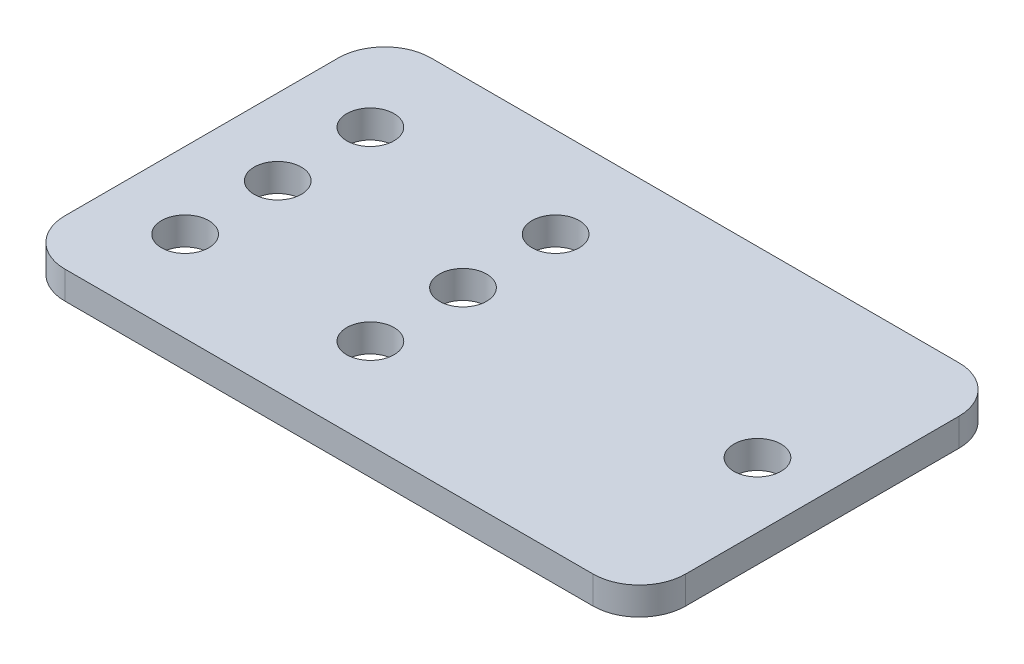
from build123d import *

# Parameters (mm, degrees)
SKETCH1_R           = 2.55
BOSS_EXTRUDE2_DEPTH = 3


with BuildPart() as part:
    # Sketch1 → Boss-Extrude2 (new body)
    with BuildSketch(Plane(origin=(0, 0, 0), x_dir=(1, 0, 0), z_dir=(0, 1, 0))):
        with BuildLine():
            Line((-5, 0), (-62, 0))
            ThreePointArc((-62, 0), (-65.535533906, 1.464466094), (-67, 5))
            Line((-67, 5), (-67, 34.5))
            ThreePointArc((-67, 34.5), (-65.535533906, 38.035533906), (-62, 39.5))
            Line((-62, 39.5), (-5, 39.5))
            ThreePointArc((-5, 39.5), (-1.464466094, 38.035533906), (0, 34.5))
            Line((0, 34.5), (0, 5))
            ThreePointArc((0, 5), (-1.464466094, 1.464466094), (-5, 0))
        make_face()
        with Locations(Location((-58.79, 29.75, 0), (0, 0, 270))):
            Circle(SKETCH1_R, mode=Mode.SUBTRACT)
        with Locations(Location((-58.79, 19.75, 0), (0, 0, 270))):
            Circle(SKETCH1_R, mode=Mode.SUBTRACT)
        with Locations(Location((-58.79, 9.75, 0), (0, 0, 270))):
            Circle(SKETCH1_R, mode=Mode.SUBTRACT)
        with Locations(Location((-38.79, 29.75, 0), (0, 0, 270))):
            Circle(SKETCH1_R, mode=Mode.SUBTRACT)
        with Locations(Location((-38.79, 19.75, 0), (0, 0, 270))):
            Circle(SKETCH1_R, mode=Mode.SUBTRACT)
        with Locations(Location((-38.79, 9.75, 0), (0, 0, 270))):
            Circle(SKETCH1_R, mode=Mode.SUBTRACT)
        with Locations(Location((-7, 19.75, 0), (0, 0, 270))):
            Circle(SKETCH1_R, mode=Mode.SUBTRACT)
    extrude(amount=BOSS_EXTRUDE2_DEPTH)


solid = part.part
